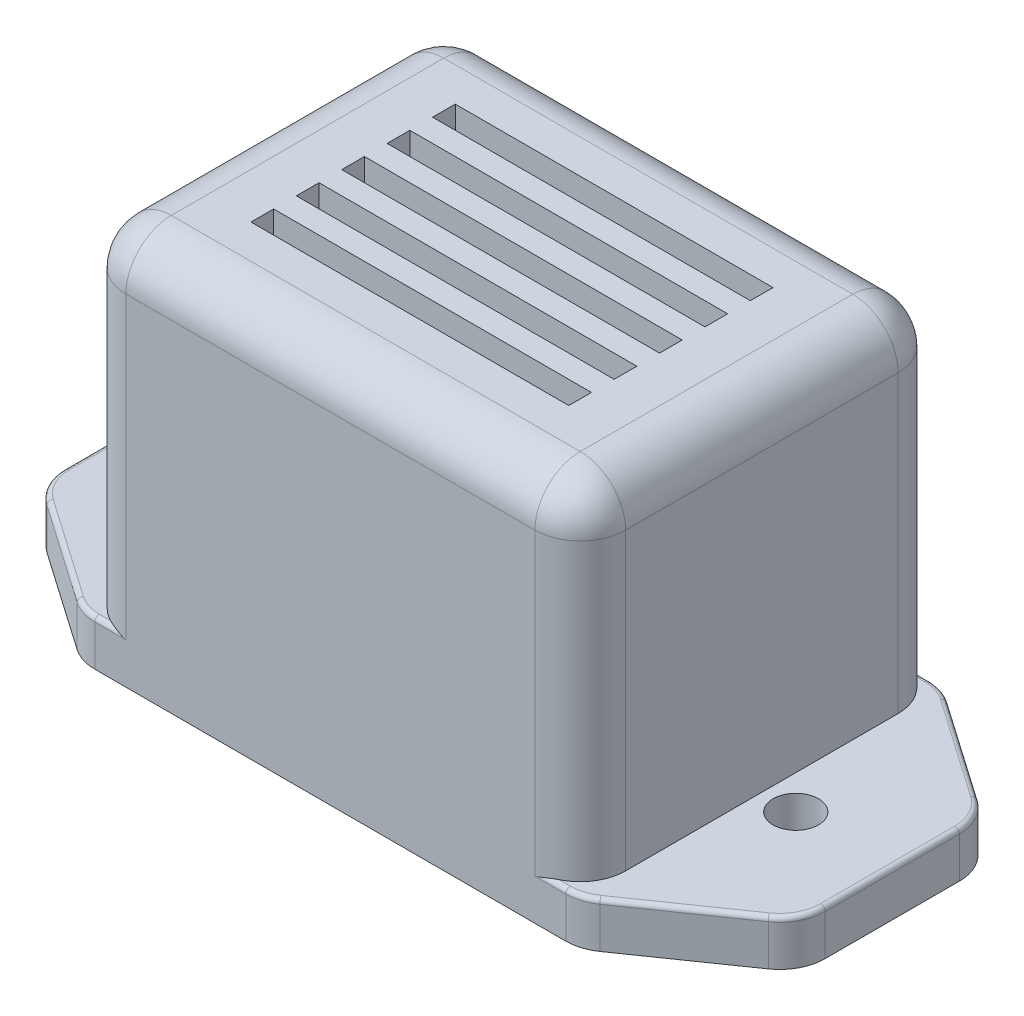
from build123d import *

# Parameters (mm, degrees)
EXTRUDE_1_DEPTH            = 2
SKETCH_2_W                 = 22.014506199136
SKETCH_2_H                 = 16
EXTRUDE_2_DEPTH            = 15
CUT_EXTRUDE_1_REACH        = 27.171
SKETCH_3_R                 = 1.0000000000000016
CUT_EXTRUDE_2_DEPTH        = 1
PATTERN_LINEAR_1_COUNT     = 3
PATTERN_LINEAR_1_PITCH     = 2
PATTERN_LINEAR_1_COL_COUNT = 3
PATTERN_LINEAR_1_COL_PITCH = 2
CUT_EXTRUDE_3_DEPTH        = 5
FILLET_4_R                 = 2
CUT_EXTRUDE_5_DEPTH        = 15
MIRROR_3_COPY_1_DEPTH      = 15
FILLET_6_R                 = 0.2
FILLET_7_R                 = 2


with BuildPart() as part:
    # 草图1 → 凸台-拉伸1 (new body)
    with BuildSketch(Plane(origin=(0, 0, 0), x_dir=(1, 0, 0), z_dir=(0, 1, 0))):
        with BuildLine():
            Line((-16.75, -4.000000000000002), (-16.75, 3.9999999999999982))
            Line((-16.75, 3.9999999999999982), (-11.51489754486675, 7.641810403570972))
            ThreePointArc((-11.51489754486675, 7.641810403570972), (-10.971257997306036, 7.908352798507383), (-10.372768568469548, 7.9999999999999964))
            Line((-10.372768568469548, 7.9999999999999964), (10.372768568469544, 8))
            ThreePointArc((10.372768568469544, 8), (10.971257997306031, 7.908352798507387), (11.514897544866734, 7.641810403570965))
            Line((11.514897544866734, 7.641810403570965), (16.75, 4.000000000000005))
            Line((16.75, 4.000000000000005), (16.75, -3.9999999999999947))
            Line((16.75, -3.9999999999999947), (11.514897544866738, -7.641810403570964))
            ThreePointArc((11.514897544866738, -7.641810403570964), (10.971257997306049, -7.908352798507378), (10.37276856846958, -7.9999999999999964))
            Line((10.37276856846958, -7.9999999999999964), (-10.372768568469548, -7.999999999999998))
            ThreePointArc((-10.372768568469548, -7.999999999999998), (-10.971257997306035, -7.908352798507385), (-11.51489754486674, -7.641810403570962))
            Line((-11.51489754486674, -7.641810403570962), (-16.75, -4.000000000000002))
        make_face()
    extrude(amount=EXTRUDE_1_DEPTH)

    # 草图2 → 凸台-拉伸2 (add)
    with BuildSketch(Plane(origin=(0, 2, 0), x_dir=(1, 0, 0), z_dir=(0, 1, 0))):
        Rectangle(SKETCH_2_W, SKETCH_2_H)
    extrude(amount=EXTRUDE_2_DEPTH)

    # 草图3 → 切除-拉伸1 (cut, up to next)
    with BuildSketch(Plane.XZ, mode=Mode.PRIVATE) as cut_extrude_1_sk1:
        with Locations(Location((-12.5, -1.53e-15, 0), (0, 0, 270))):
            Circle(SKETCH_3_R)
    cut_extrude_1_tool1 = extrude(cut_extrude_1_sk1.sketch, amount=-CUT_EXTRUDE_1_REACH, mode=Mode.PRIVATE) & part.part
    cut_extrude_1 = cut_extrude_1_tool1.solids().sort_by_distance((-12.5, 0, 0))[0]
    add(cut_extrude_1, mode=Mode.SUBTRACT)

    # 镜向1: 切除-拉伸1 across plane
    add(cut_extrude_1.mirror(Plane(origin=(0, 0, 0), x_dir=(0, 0, 1), z_dir=(1, 0, 0))), mode=Mode.SUBTRACT)

    # 草图4 → 切除-拉伸2 (cut)
    with BuildSketch(Plane(origin=(0, 17, 0), x_dir=(1, 0, 0), z_dir=(0, 1, 0))):
        Polygon((0, 0.5), (7, 0.5), (7, -0.5), (0, -0.5), (-7, -0.5), (-7, 0.5), align=None)
    cut_extrude_2 = extrude(amount=-CUT_EXTRUDE_2_DEPTH, mode=Mode.SUBTRACT)

    # 阵列(线性)1: 切除-拉伸2 ×3
    with Locations(*[(0, 0, i * PATTERN_LINEAR_1_PITCH) for i in range(1, PATTERN_LINEAR_1_COUNT)]):
        add(cut_extrude_2, mode=Mode.SUBTRACT)

    # 阵列(线性)1 col: 切除-拉伸2 ×3
    with Locations(*[(0, 0, -i * PATTERN_LINEAR_1_COL_PITCH) for i in range(1, PATTERN_LINEAR_1_COL_COUNT)]):
        add(cut_extrude_2, mode=Mode.SUBTRACT)

    # 草图5 → 切除-拉伸3 (cut)
    with BuildSketch(Plane(origin=(0, 16, 0), x_dir=(1, 0, 0), z_dir=(0, 1, 0))):
        Polygon((9, 6.0000000000000036), (9.000000000000002, -5.999999999999997), (-8.999999999999998, -6.000000000000001), (-8.999999999999998, 5.999999999999999), align=None)
    extrude(amount=-CUT_EXTRUDE_3_DEPTH, mode=Mode.SUBTRACT)

    # 圆角4
    fillet_4_edges = [part.edges().sort_by_distance(p)[0] for p in [
        (-16.75, 1, 4.000000000000002),
        (-16.75, 1, -3.9999999999999982),
        (16.75, 1, -4.000000000000005),
        (16.75, 1, 3.9999999999999947),
    ]]
    fillet(fillet_4_edges, radius=FILLET_4_R)

    # 草图8 → 切除-拉伸5 (cut)
    with BuildSketch(Plane(origin=(0, 17, 0), x_dir=(1, 0, 0), z_dir=(0, 1, 0))):
        with BuildLine():
            Line((-9.007253099567999, 8), (-11.007253099568, 8))
            Line((-11.007253099568, 8), (-11.007253099568, 6))
            ThreePointArc((-11.007253099568, 6), (-10.421466661941093, 7.414213562373095), (-9.007253099567999, 8))
        make_face()
    cut_extrude_5 = extrude(amount=-CUT_EXTRUDE_5_DEPTH, mode=Mode.SUBTRACT)

    # 镜向2: 切除-拉伸5 across plane
    add(cut_extrude_5.mirror(Plane(origin=(0, 0, 0), x_dir=(0, 0, 1), z_dir=(1, 0, 0))), mode=Mode.SUBTRACT)

    # 镜向3: 切除-拉伸5 across plane
    add(cut_extrude_5.mirror(Plane.XY), mode=Mode.SUBTRACT)

    # 镜向3 copy 1 sketch → 镜向3 copy 1 (cut)
    with BuildSketch(Plane(origin=(0, 17, 0), x_dir=(-1, 0, 0), z_dir=(0, 1, 0))):
        with BuildLine():
            Line((-9.007253099567999, 8), (-11.007253099568, 8))
            Line((-11.007253099568, 8), (-11.007253099568, 6))
            ThreePointArc((-11.007253099568, 6), (-10.421466661941093, 7.414213562373095), (-9.007253099567999, 8))
        make_face()
    extrude(amount=-MIRROR_3_COPY_1_DEPTH, mode=Mode.SUBTRACT)

    # 圆角6
    fillet_6_edges = [part.edges().sort_by_distance(p)[0] for p in [
        (10.971257997306049, 2, 7.908352798507378),
        (13.703513260631969, 2, 6.119295123038627),
        (-16.75, 2, -8.9e-16),
        (-13.70351326063197, 2, 6.119295123038629),
        (-16.522605138319644, 2, 3.881182710057475),
        (-16.522605138319644, 2, -3.881182710057476),
        (13.703513260631965, 2, -6.119295123038633),
        (16.75, 2, -3.55e-15),
        (16.522605138319644, 2, 3.8811827100574723),
        (16.52260513831964, 2, -3.8811827100574794),
        (-9.690010834018773, 2, -8),
        (9.690010834018771, 2, -8),
        (-9.690010834018773, 2, 8),
        (9.69001083401879, 2, 8),
        (10.97125799730603, 2, -7.908352798507387),
        (-10.971257997306036, 2, -7.908352798507383),
        (-13.703513260631976, 2, -6.119295123038633),
        (-10.971257997306035, 2, 7.908352798507385),
    ]]
    fillet(fillet_6_edges, radius=FILLET_6_R)

    # 圆角7
    fillet_7_edges = [part.edges().sort_by_distance(p)[0] for p in [
        (-11.007253099568, 17, 0),
        (-10.421466661941095, 17, -7.414213562373094),
        (1.78e-15, 17, -8),
        (10.421466661941095, 17, -7.414213562373094),
        (-1.78e-15, 17, 8),
        (-10.421466661941095, 17, 7.414213562373094),
        (11.007253099568, 17, 0),
        (10.421466661941095, 17, 7.414213562373094),
    ]]
    fillet(fillet_7_edges, radius=FILLET_7_R)


solid = part.part
